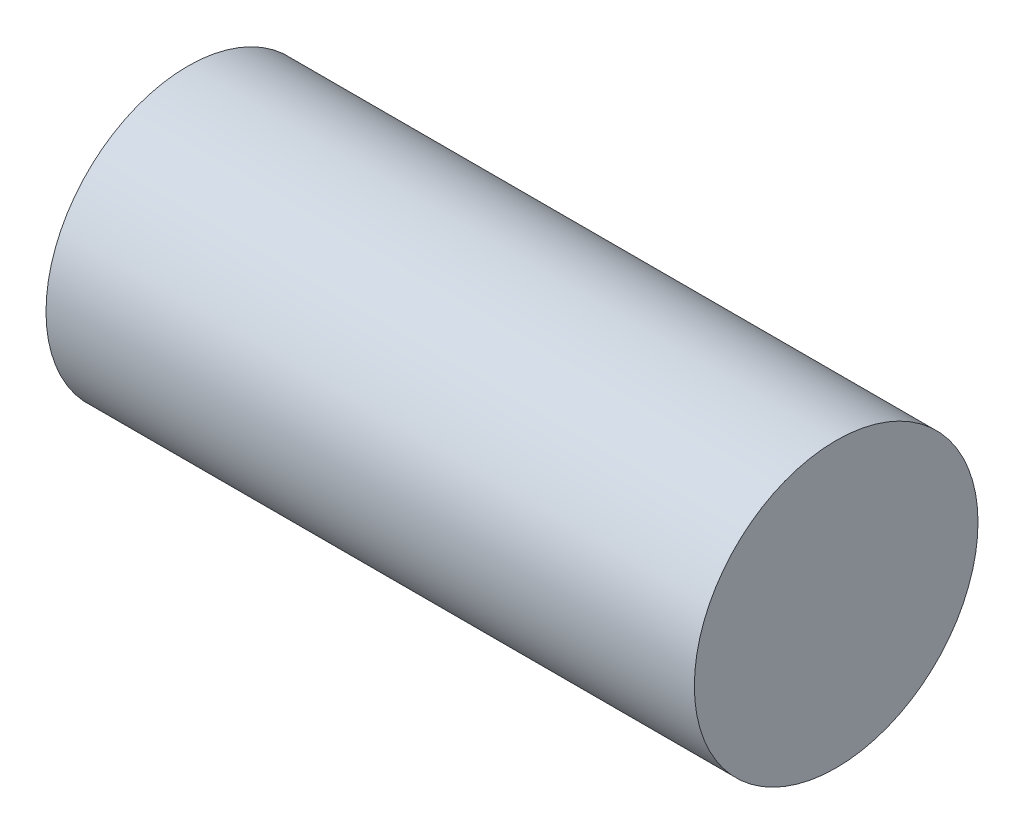
from build123d import *

# Parameters (mm, degrees)
SKETCH1_R           = 1.75
BOSS_EXTRUDE1_DEPTH = 8


with BuildPart() as part:
    # Sketch1 → Boss-Extrude1 (new body)
    with BuildSketch(Plane.ZY.offset(60.382025879)):
        with Locations(Location((-48.476847853, 27.6716735, 0), (0, 0, 270))):
            Circle(SKETCH1_R)
    extrude(amount=BOSS_EXTRUDE1_DEPTH)


solid = part.part
